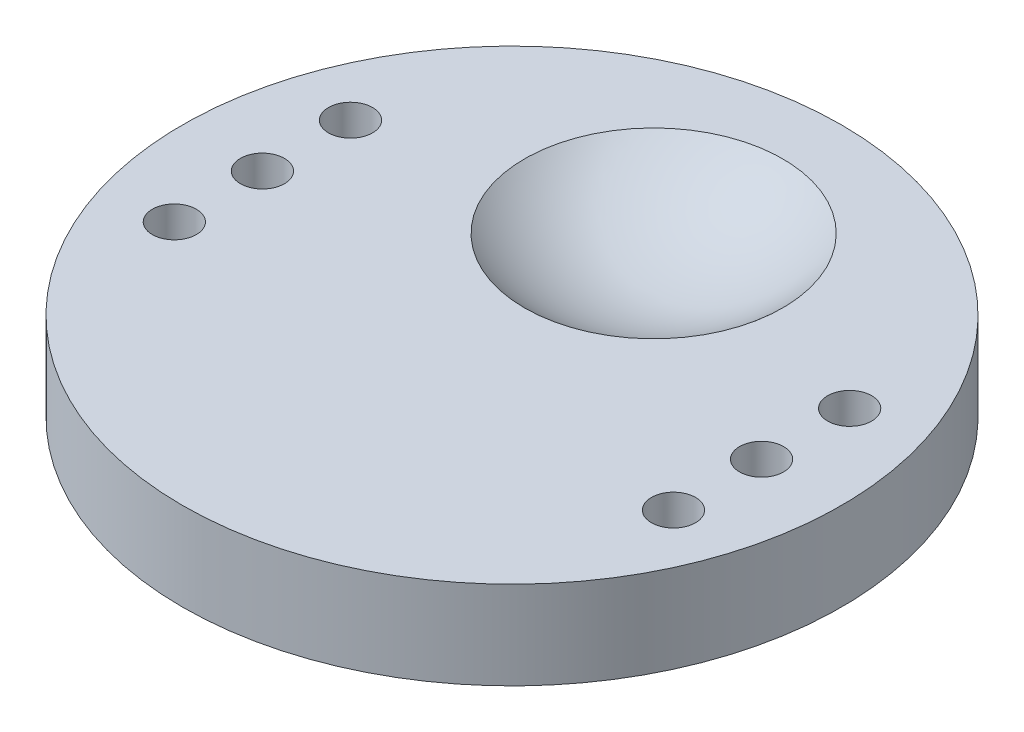
from build123d import *

# Parameters (mm, degrees)
SKETCH1_R           = 37.4142
SKETCH1_R_2         = 2.5
BOSS_EXTRUDE1_DEPTH = 10


with BuildPart() as part:
    # Sketch1 → Boss-Extrude1 (new body)
    with BuildSketch(Plane(origin=(0, 0, 0), x_dir=(1, 0, 0), z_dir=(0, 1, 0))):
        with Locations(Location((0, 0, 0), (0, 0, 270))):
            Circle(SKETCH1_R)
        with Locations(Location((-28.335, 0, 0), (0, 0, 270))):
            Circle(SKETCH1_R_2, mode=Mode.SUBTRACT)
        with Locations(Location((28.335, 0, 0), (0, 0, 90))):
            Circle(SKETCH1_R_2, mode=Mode.SUBTRACT)
        with Locations(Location((-28.335, 10, 0), (0, 0, 270))):
            Circle(SKETCH1_R_2, mode=Mode.SUBTRACT)
        with Locations(Location((-28.335, -10, 0), (0, 0, 270))):
            Circle(SKETCH1_R_2, mode=Mode.SUBTRACT)
        with Locations(Location((28.335, -10, 0), (0, 0, 90))):
            Circle(SKETCH1_R_2, mode=Mode.SUBTRACT)
        with Locations(Location((28.335, 10, 0), (0, 0, 90))):
            Circle(SKETCH1_R_2, mode=Mode.SUBTRACT)
    extrude(amount=BOSS_EXTRUDE1_DEPTH)

    # Sketch2 → Cut-Revolve12 (revolve, cut)
    with BuildSketch(Plane(origin=(0, 0, 0), x_dir=(0, 0, -1), z_dir=(1, 0, 0))):
        with BuildLine():
            Line((16.0792, 46.835), (16.0792, 4.165))
            ThreePointArc((16.0792, 4.165), (37.4142, 25.5), (16.0792, 46.835))
        make_face()
    revolve(axis=Axis((0, 52.533559147, -16.0792), (0, 1, 0)), mode=Mode.SUBTRACT)


solid = part.part
